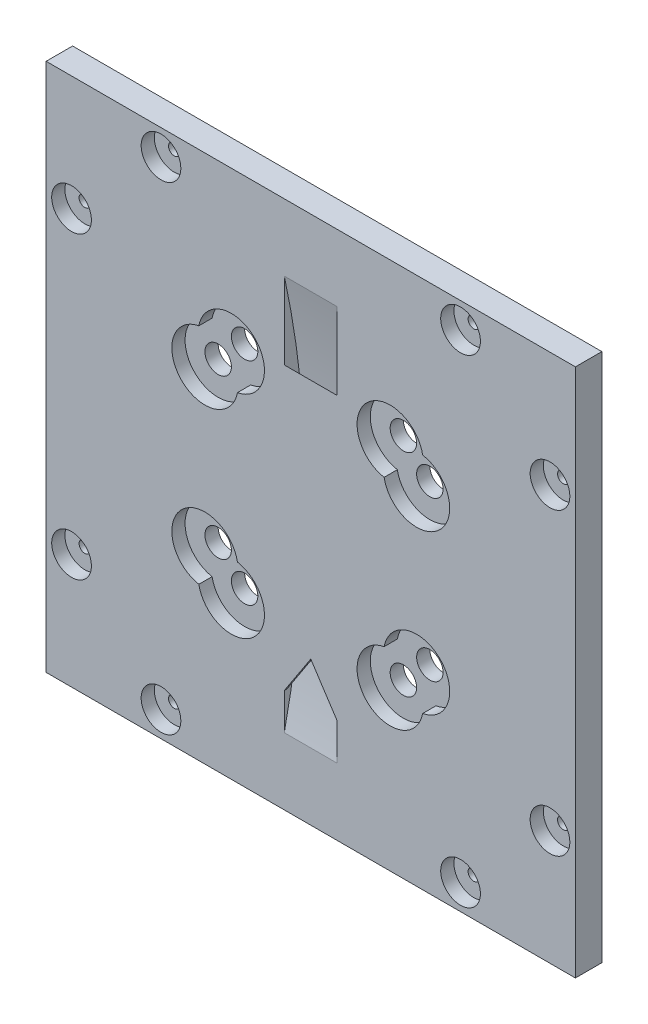
from build123d import *

# Parameters (mm, degrees)
SKETCH1_W           = 200
SKETCH1_H           = 200
BOSS_EXTRUDE1_DEPTH = 10
SKETCH2_R           = 5
SKETCH2_R_2         = 2.15
CUT_EXTRUDE1_DEPTH  = 142.774468788
SKETCH3_W           = 20
SKETCH3_H           = 5
SKETCH4_R           = 12.5
SKETCH4_R_2         = 5
SKETCH4_R_3         = 7.5
SKETCH4_R_4         = 2.15
CUT_EXTRUDE2_DEPTH  = 5
BOSS_EXTRUDE3_DEPTH = 1


with BuildPart() as part:
    # Sketch1 → Boss-Extrude1 (new body)
    with BuildSketch(Plane.XY):
        Rectangle(SKETCH1_W, SKETCH1_H)
    extrude(amount=BOSS_EXTRUDE1_DEPTH)

    # Sketch2 → Cut-Extrude1 (cut, through all)
    with BuildSketch(Plane.XY.offset(10)):
        with Locations((-40, 30)):
            Circle(SKETCH2_R)
        with Locations((40, 30)):
            Circle(SKETCH2_R)
        with Locations((40, -30)):
            Circle(SKETCH2_R)
        with Locations((-40, -30)):
            Circle(SKETCH2_R)
        with Locations((-30, 40)):
            Circle(SKETCH2_R)
        with Locations((30, 40)):
            Circle(SKETCH2_R)
        with Locations((30, -40)):
            Circle(SKETCH2_R)
        with Locations((-30, -40)):
            Circle(SKETCH2_R)
        with Locations((-56.6, 90.4)):
            Circle(SKETCH2_R_2)
        with Locations((-90.4, 56.6)):
            Circle(SKETCH2_R_2)
        with Locations((-90.4, -56.6)):
            Circle(SKETCH2_R_2)
        with Locations((-56.6, -90.4)):
            Circle(SKETCH2_R_2)
        with Locations((56.6, -90.4)):
            Circle(SKETCH2_R_2)
        with Locations((90.4, -56.6)):
            Circle(SKETCH2_R_2)
        with Locations((90.4, 56.6)):
            Circle(SKETCH2_R_2)
        with Locations((56.6, 90.4)):
            Circle(SKETCH2_R_2)
    extrude(amount=-CUT_EXTRUDE1_DEPTH, mode=Mode.SUBTRACT)

    # Sketch3 → Cut-Revolve1 (revolve, cut)
    with BuildSketch(Plane(origin=(0, 0, 0), x_dir=(1, 0, 0), z_dir=(0, 1, 0))):
        with Locations((0, -4.492265688)):
            Rectangle(SKETCH3_W, SKETCH3_H)
    revolve(axis=Axis((0, 0, 354.492265688), (1, 0, 0)), mode=Mode.SUBTRACT)

    # Sketch4 → Cut-Extrude2 (cut)
    # profile 1 of 30: a face of its own
    with BuildSketch(Plane.XY.offset(10)):
        with Locations((40, 30)):
            Circle(SKETCH4_R)
    # profile 2 of 30: a face of its own
    with BuildSketch(Plane.XY.offset(10)):
        with Locations((30, 40)):
            Circle(SKETCH4_R)
        with Locations((30, 40)):
            Circle(SKETCH4_R_2, mode=Mode.SUBTRACT)
    # profile 3 of 30: a face of its own
    with BuildSketch(Plane.XY.offset(10)):
        with Locations((30, 40)):
            Circle(SKETCH4_R)
        with Locations((30, 40)):
            Circle(SKETCH4_R_2, mode=Mode.SUBTRACT)
    # profile 4 of 30: a face of its own
    with BuildSketch(Plane.XY.offset(10)):
        with Locations((40, 30)):
            Circle(SKETCH4_R)
        with Locations((40, 30)):
            Circle(SKETCH4_R_2, mode=Mode.SUBTRACT)
    # profile 5 of 30: a face of its own
    with BuildSketch(Plane.XY.offset(10)):
        with Locations((30, 40)):
            Circle(SKETCH4_R)
    # profile 6 of 30: a face of its own
    with BuildSketch(Plane.XY.offset(10)):
        with Locations((40, 30)):
            Circle(SKETCH4_R)
        with Locations((40, 30)):
            Circle(SKETCH4_R_2, mode=Mode.SUBTRACT)
    # profile 7 of 30: a face of its own
    with BuildSketch(Plane.XY.offset(10)):
        with Locations((30, -40)):
            Circle(SKETCH4_R)
    # profile 8 of 30: a face of its own
    with BuildSketch(Plane.XY.offset(10)):
        with Locations((40, -30)):
            Circle(SKETCH4_R)
        with Locations((40, -30)):
            Circle(SKETCH4_R_2, mode=Mode.SUBTRACT)
    # profile 9 of 30: a face of its own
    with BuildSketch(Plane.XY.offset(10)):
        with Locations((30, -40)):
            Circle(SKETCH4_R)
        with Locations((30, -40)):
            Circle(SKETCH4_R_2, mode=Mode.SUBTRACT)
    # profile 10 of 30: a face of its own
    with BuildSketch(Plane.XY.offset(10)):
        with Locations((40, -30)):
            Circle(SKETCH4_R)
        with Locations((40, -30)):
            Circle(SKETCH4_R_2, mode=Mode.SUBTRACT)
    # profile 11 of 30: a face of its own
    with BuildSketch(Plane.XY.offset(10)):
        with Locations((40, -30)):
            Circle(SKETCH4_R)
    # profile 12 of 30: a face of its own
    with BuildSketch(Plane.XY.offset(10)):
        with Locations((30, -40)):
            Circle(SKETCH4_R)
        with Locations((30, -40)):
            Circle(SKETCH4_R_2, mode=Mode.SUBTRACT)
    # profile 13 of 30: a face of its own
    with BuildSketch(Plane.XY.offset(10)):
        with Locations((-30, -40)):
            Circle(SKETCH4_R)
    # profile 14 of 30: a face of its own
    with BuildSketch(Plane.XY.offset(10)):
        with Locations((-40, -30)):
            Circle(SKETCH4_R)
        with Locations((-40, -30)):
            Circle(SKETCH4_R_2, mode=Mode.SUBTRACT)
    # profile 15 of 30: a face of its own
    with BuildSketch(Plane.XY.offset(10)):
        with Locations((-30, -40)):
            Circle(SKETCH4_R)
        with Locations((-30, -40)):
            Circle(SKETCH4_R_2, mode=Mode.SUBTRACT)
    # profile 16 of 30: a face of its own
    with BuildSketch(Plane.XY.offset(10)):
        with Locations((-40, -30)):
            Circle(SKETCH4_R)
        with Locations((-40, -30)):
            Circle(SKETCH4_R_2, mode=Mode.SUBTRACT)
    # profile 17 of 30: a face of its own
    with BuildSketch(Plane.XY.offset(10)):
        with Locations((-40, 30)):
            Circle(SKETCH4_R)
    # profile 18 of 30: a face of its own
    with BuildSketch(Plane.XY.offset(10)):
        with Locations((-30, 40)):
            Circle(SKETCH4_R)
        with Locations((-30, 40)):
            Circle(SKETCH4_R_2, mode=Mode.SUBTRACT)
    # profile 19 of 30: a face of its own
    with BuildSketch(Plane.XY.offset(10)):
        with Locations((-40, 30)):
            Circle(SKETCH4_R)
        with Locations((-40, 30)):
            Circle(SKETCH4_R_2, mode=Mode.SUBTRACT)
    # profile 20 of 30: a face of its own
    with BuildSketch(Plane.XY.offset(10)):
        with Locations((-30, 40)):
            Circle(SKETCH4_R)
        with Locations((-30, 40)):
            Circle(SKETCH4_R_2, mode=Mode.SUBTRACT)
    # profile 21 of 30: a face of its own
    with BuildSketch(Plane.XY.offset(10)):
        with Locations((-30, 40)):
            Circle(SKETCH4_R)
    # profile 22 of 30: a face of its own
    with BuildSketch(Plane.XY.offset(10)):
        with Locations((-40, 30)):
            Circle(SKETCH4_R)
        with Locations((-40, 30)):
            Circle(SKETCH4_R_2, mode=Mode.SUBTRACT)
    # profile 23 of 30: a face of its own
    with BuildSketch(Plane.XY.offset(10)):
        with Locations((-56.6, 90.4)):
            Circle(SKETCH4_R_3)
        with Locations((-56.6, 90.4)):
            Circle(SKETCH4_R_4, mode=Mode.SUBTRACT)
    # profile 24 of 30: a face of its own
    with BuildSketch(Plane.XY.offset(10)):
        with Locations((-90.4, 56.6)):
            Circle(SKETCH4_R_3)
        with Locations((-90.4, 56.6)):
            Circle(SKETCH4_R_4, mode=Mode.SUBTRACT)
    # profile 25 of 30: a face of its own
    with BuildSketch(Plane.XY.offset(10)):
        with Locations((56.6, -90.4)):
            Circle(SKETCH4_R_3)
        with Locations((56.6, -90.4)):
            Circle(SKETCH4_R_4, mode=Mode.SUBTRACT)
    # profile 26 of 30: a face of its own
    with BuildSketch(Plane.XY.offset(10)):
        with Locations((90.4, -56.6)):
            Circle(SKETCH4_R_3)
        with Locations((90.4, -56.6)):
            Circle(SKETCH4_R_4, mode=Mode.SUBTRACT)
    # profile 27 of 30: a face of its own
    with BuildSketch(Plane.XY.offset(10)):
        with Locations((90.4, 56.6)):
            Circle(SKETCH4_R_3)
        with Locations((90.4, 56.6)):
            Circle(SKETCH4_R_4, mode=Mode.SUBTRACT)
    # profile 28 of 30: a face of its own
    with BuildSketch(Plane.XY.offset(10)):
        with Locations((56.6, 90.4)):
            Circle(SKETCH4_R_3)
        with Locations((56.6, 90.4)):
            Circle(SKETCH4_R_4, mode=Mode.SUBTRACT)
    # profile 29 of 30: a face of its own
    with BuildSketch(Plane.XY.offset(10)):
        with Locations((-90.4, -56.6)):
            Circle(SKETCH4_R_3)
    # profile 30 of 30: a face of its own
    with BuildSketch(Plane.XY.offset(10)):
        with Locations((-56.6, -90.4)):
            Circle(SKETCH4_R_3)
    extrude(amount=-CUT_EXTRUDE2_DEPTH, mode=Mode.SUBTRACT)

    # Sketch6 → Boss-Extrude3 (add)
    with BuildSketch(Plane.XY.offset(10)):
        Polygon((10, -45.621583501), (0, -45.621583501), (10, -60.912010155), align=None)
        Polygon((-10, -45.621583501), (0, -45.621583501), (10, -45.621583501), (10, -37.997610078), (-10, -37.997610078), align=None)
        Polygon((-10, -60.912010155), (0, -45.621583501), (-10, -45.621583501), align=None)
    extrude(amount=-BOSS_EXTRUDE3_DEPTH)


solid = part.part
